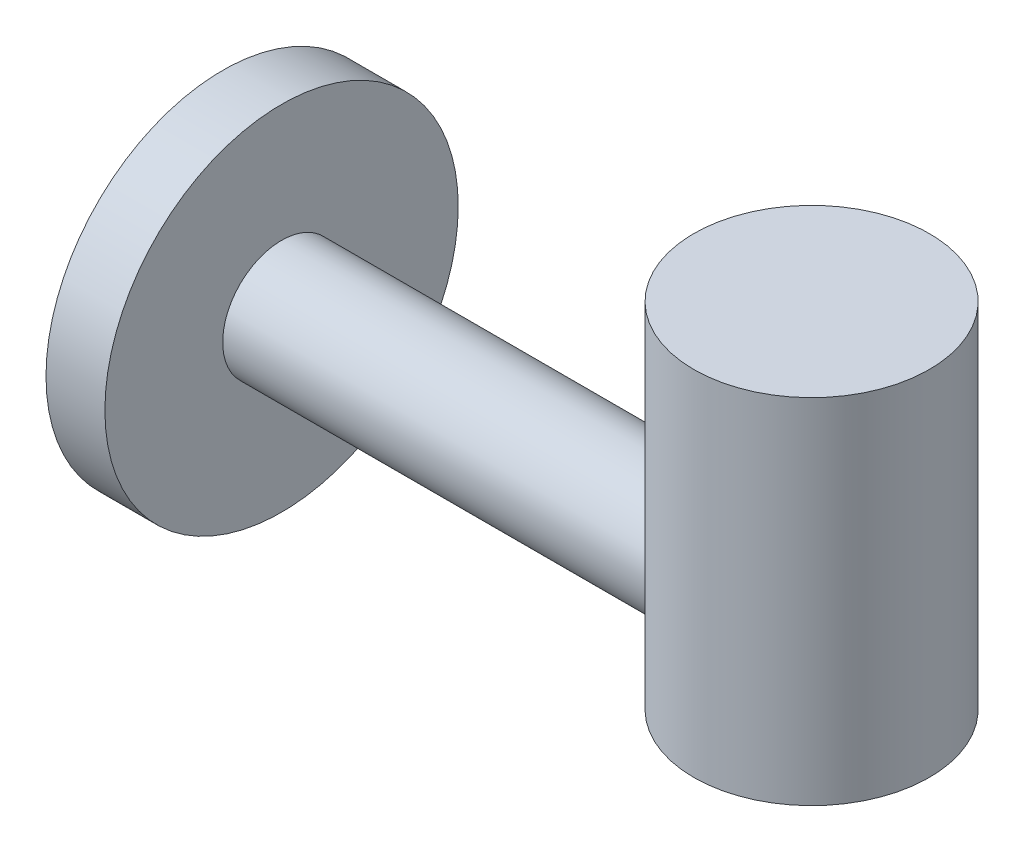
from build123d import *

# Parameters (mm, degrees)
SKETCH_1_R      = 10
EXTRUDE_1_DEPTH = 30
SKETCH_3_R      = 5
EXTRUDE_3_DEPTH = 45
SKETCH_4_R      = 15
EXTRUDE_4_DEPTH = 5


with BuildPart() as part:
    # 草图1 → 凸台-拉伸1 (new body)
    with BuildSketch(Plane(origin=(0, 0, 0), x_dir=(1, 0, 0), z_dir=(0, 1, 0))):
        with Locations(Location((0, 0, 0), (0, 0, 270))):
            Circle(SKETCH_1_R)
    extrude(amount=EXTRUDE_1_DEPTH)

    # 草图3 → 凸台-拉伸3 (add)
    with BuildSketch(Plane(origin=(0, 0, 0), x_dir=(0, 0, -1), z_dir=(1, 0, 0))):
        with Locations((0, 7)):
            Circle(SKETCH_3_R)
    extrude(amount=-EXTRUDE_3_DEPTH)

    # 草图4 → 凸台-拉伸4 (add)
    with BuildSketch(Plane.ZY.offset(45)):
        with Locations((0, 7)):
            Circle(SKETCH_4_R)
    extrude(amount=EXTRUDE_4_DEPTH)


solid = part.part
